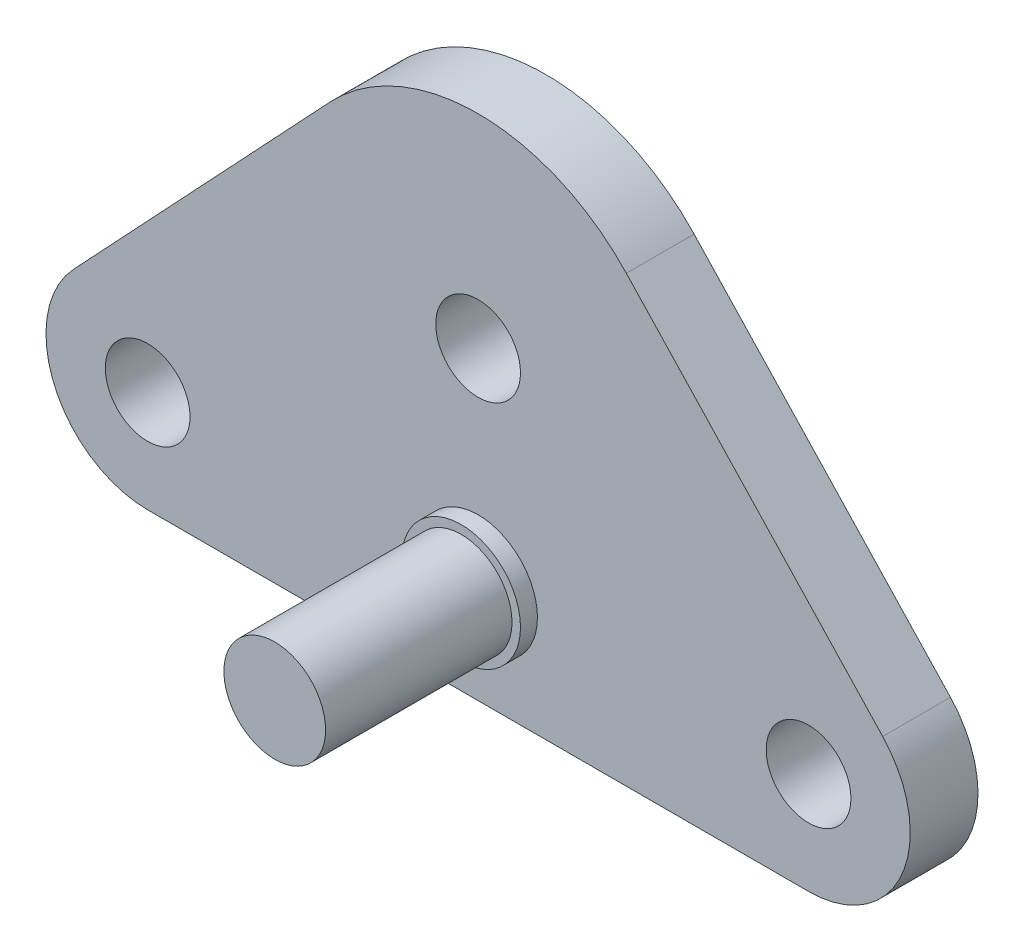
from build123d import *

# Parameters (mm, degrees)
ESQUISSE1_R        = 1.25
BOSS_EXTRU_1_DEPTH = 2
ESQUISSE2_R        = 1.5
BOSS_EXTRU_2_DEPTH = 6
ESQUISSE3_R        = 1.75
BOSS_EXTRU_3_DEPTH = 0.5


with BuildPart() as part:
    # Esquisse1 → Boss.-Extru.1 (new body)
    with BuildSketch(Plane.XY):
        with BuildLine():
            Line((9.75, -3), (-9.75, -3))
            ThreePointArc((-9.75, -3), (-12.503272584, -1.191423551), (-11.936875866, 2.053673282))
            Line((-11.936875866, 2.053673282), (-4.373751731, 10.107346563))
            ThreePointArc((-4.373751731, 10.107346563), (0, 12), (4.373751731, 10.107346563))
            Line((4.373751731, 10.107346563), (11.936875866, 2.053673282))
            ThreePointArc((11.936875866, 2.053673282), (12.503272584, -1.191423551), (9.75, -3))
        make_face()
        with Locations((0, 6)):
            Circle(ESQUISSE1_R, mode=Mode.SUBTRACT)
        with Locations((9.75, 0)):
            Circle(ESQUISSE1_R, mode=Mode.SUBTRACT)
        with Locations((-9.75, 0)):
            Circle(ESQUISSE1_R, mode=Mode.SUBTRACT)
    extrude(amount=BOSS_EXTRU_1_DEPTH)

    # Esquisse2 → Boss.-Extru.2 (add)
    with BuildSketch(Plane.XY.offset(2)):
        Circle(ESQUISSE2_R)
    extrude(amount=BOSS_EXTRU_2_DEPTH)

    # Esquisse3 → Boss.-Extru.3 (add)
    with BuildSketch(Plane.XY.offset(2)):
        Circle(ESQUISSE3_R)
    extrude(amount=BOSS_EXTRU_3_DEPTH)


solid = part.part
